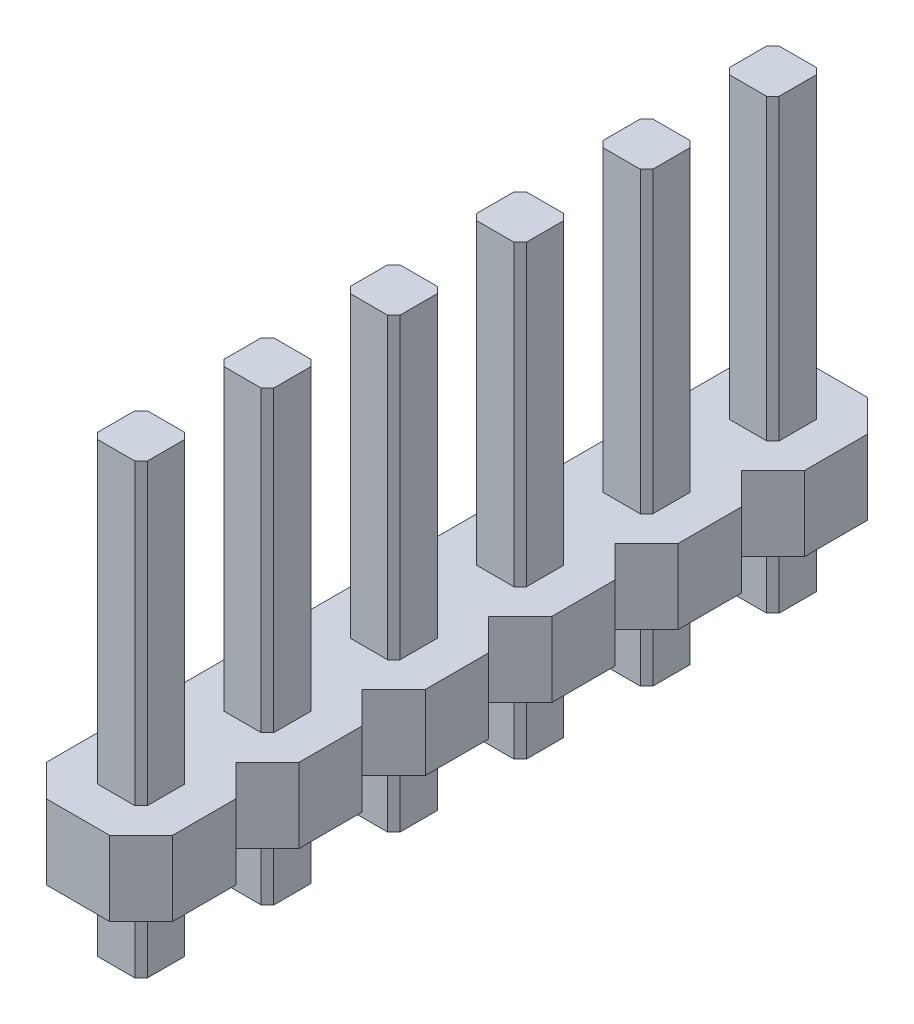
from build123d import *

# Parameters (mm, degrees)
BOSS_EXTRUDE1_DEPTH      = 1.5
BOSS_EXTRUDE2_DEPTH      = 6
BOSS_EXTRUDE2_DEPTH_BACK = 3


with BuildPart() as part:
    # Sketch1 → Boss-Extrude1 (new body)
    with BuildSketch(Plane(origin=(0, 0, 0), x_dir=(1, 0, 0), z_dir=(0, 1, 0))):
        Polygon((-0.635, 10.16), (0.635, 10.16), (1.27, 9.525), (1.27, 8.255), (0.635, 7.62), (1.27, 6.985), (1.27, 5.715), (0.635, 5.08), (1.27, 4.445), (1.27, 3.175), (0.635, 2.54), (1.27, 1.905), (1.27, 0.635), (0.635, 0), (1.27, -0.635), (1.27, -1.905), (0.635, -2.54), (1.27, -3.175), (1.27, -4.445), (0.635, -5.08), (-0.635, -5.08), (-1.27, -4.445), (-1.27, -3.175), (-0.635, -2.54), (-1.27, -1.905), (-1.27, -0.635), (-0.635, 0), (-1.27, 0.635), (-1.27, 1.905), (-0.635, 2.54), (-1.27, 3.175), (-1.27, 4.445), (-0.635, 5.08), (-1.27, 5.715), (-1.27, 6.985), (-0.635, 7.62), (-1.27, 8.255), (-1.27, 9.525), align=None)
    extrude(amount=BOSS_EXTRUDE1_DEPTH)

    # Sketch3 → Boss-Extrude2 (add, two sides: drawn at the far end of the back side and taken through both)
    with BuildSketch(Plane(origin=(0, 1.5, 0), x_dir=(1, 0, 0), z_dir=(0, 1, 0)).offset(-BOSS_EXTRUDE2_DEPTH_BACK)):
        Polygon((0.375, 9.39), (0.5, 9.265), (0.5, 8.515), (0.375, 8.39), (-0.375, 8.39), (-0.5, 8.515), (-0.5, 9.265), (-0.375, 9.39), align=None)
        Polygon((0.375, 6.85), (0.5, 6.725), (0.5, 5.975), (0.375, 5.85), (-0.375, 5.85), (-0.5, 5.975), (-0.5, 6.725), (-0.375, 6.85), align=None)
        Polygon((0.375, 4.31), (0.5, 4.185), (0.5, 3.435), (0.375, 3.31), (-0.375, 3.31), (-0.5, 3.435), (-0.5, 4.185), (-0.375, 4.31), align=None)
        Polygon((0.375, 1.77), (0.5, 1.645), (0.5, 0.895), (0.375, 0.77), (-0.375, 0.77), (-0.5, 0.895), (-0.5, 1.645), (-0.375, 1.77), align=None)
        Polygon((0.375, -0.77), (0.5, -0.895), (0.5, -1.645), (0.375, -1.77), (-0.375, -1.77), (-0.5, -1.645), (-0.5, -0.895), (-0.375, -0.77), align=None)
        Polygon((0.375, -3.31), (0.5, -3.435), (0.5, -4.185), (0.375, -4.31), (-0.375, -4.31), (-0.5, -4.185), (-0.5, -3.435), (-0.375, -3.31), align=None)
    extrude(amount=BOSS_EXTRUDE2_DEPTH + BOSS_EXTRUDE2_DEPTH_BACK)


solid = part.part
